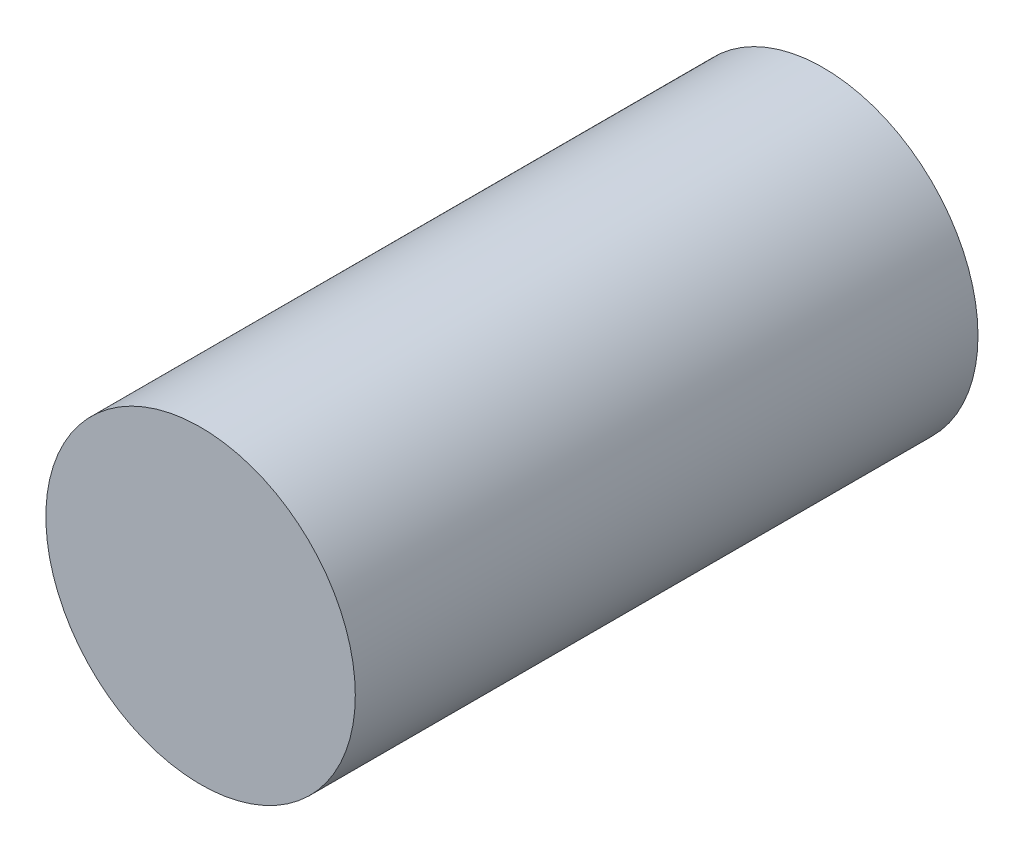
from build123d import *

# Parameters (mm, degrees)
SKETCH1_R           = 8.2
BOSS_EXTRUDE1_DEPTH = 33
SKETCH2_R           = 3
BOSS_EXTRUDE2_DEPTH = 34


with BuildPart() as part:
    # Sketch1 → Boss-Extrude1 (new body)
    with BuildSketch(Plane.XY):
        Circle(SKETCH1_R)
    extrude(amount=BOSS_EXTRUDE1_DEPTH)

    # Sketch2 → Boss-Extrude2 (add)
    with BuildSketch(Plane.XY.offset(33)):
        Circle(SKETCH2_R)
    extrude(amount=-BOSS_EXTRUDE2_DEPTH)


solid = part.part
